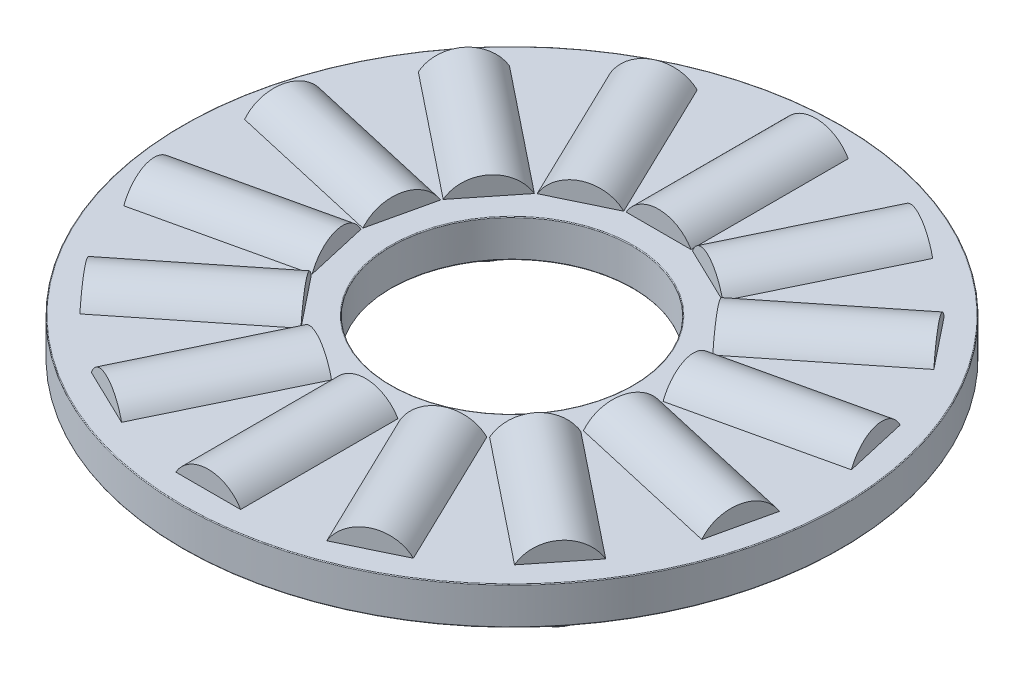
from build123d import *

# Parameters (mm, degrees)
SKETCH1_W         = 5.53085
SKETCH1_H         = 0.9921875
SKETCH3_W         = 4.1671875
SKETCH3_H         = 0.9921875
SKETCH2_W         = 4.1671875
SKETCH2_H         = 0.9921875
CIRPATTERN1_COUNT = 14
CIRPATTERN1_ANGLE = 334.285714286
CIRPATTERN2_COUNT = 14
FILLET2_R         = 0.01984375


with BuildPart() as part:
    # Sketch1 → Revolve1 (revolve)
    with BuildSketch(Plane(origin=(0, 0, 0), x_dir=(0, 0, -1), z_dir=(1, 0, 0)), mode=Mode.PRIVATE) as revolve1_sk:
        with Locations((-5.965825, 0)):
            Rectangle(SKETCH1_W, SKETCH1_H)
    revolve(revolve1_sk.sketch.rotate(Axis((0, -0.9921875, 0), (0, 1, 0)), 180), axis=Axis((0, -0.9921875, 0), (0, 1, 0)))

    # Sketch3 → Cut-Revolve1 (revolve, cut)
    with BuildSketch(Plane(origin=(0, 0, 0), x_dir=(0, 0, -1), z_dir=(1, 0, 0))):
        with Locations((-5.965825, 0.49609375)):
            Rectangle(SKETCH3_W, SKETCH3_H)
    cut_revolve1 = revolve(axis=Axis((0, 0, 8.04941875), (0, 0, -1)), mode=Mode.SUBTRACT)

    # CirPattern2: Cut-Revolve1 ×14 about axis
    cirpattern2_axis = Axis((0, 0, 0), (0, 1, 0))
    for i in range(1, CIRPATTERN2_COUNT):
        add(cut_revolve1.rotate(cirpattern2_axis, i * 360 / CIRPATTERN2_COUNT), mode=Mode.SUBTRACT)

    # Fillet2
    fillet2_edges = [part.edges().sort_by_distance(p)[0] for p in [
        (0, 0.49609375, 8.73125),
        (0, 0.49609375, 3.2004),
        (0, -0.49609375, 3.2004),
        (0, -0.49609375, 8.73125),
    ]]
    fillet(fillet2_edges, radius=FILLET2_R)


with BuildPart() as body_2:
    # Sketch2 → Revolve2 (revolve)
    with BuildSketch(Plane(origin=(0, 0, 0), x_dir=(0, 0, -1), z_dir=(1, 0, 0)), mode=Mode.PRIVATE) as revolve2_sk:
        with Locations((-5.965825, 0.49609375)):
            Rectangle(SKETCH2_W, SKETCH2_H)
    revolve(revolve2_sk.sketch.rotate(Axis((0, 0, 8.04941875), (0, 0, -1)), 90), axis=Axis((0, 0, 8.04941875), (0, 0, -1)))


with BuildPart() as cirpattern1_1:
    # CirPattern1: pattern copy
    add(body_2.part.rotate(Axis((0, 0.9921875, 0), (0, -1, 0)), 1 * CIRPATTERN1_ANGLE / (CIRPATTERN1_COUNT - 1)))


with BuildPart() as cirpattern1_2:
    # CirPattern1: pattern copy
    add(body_2.part.rotate(Axis((0, 0.9921875, 0), (0, -1, 0)), 2 * CIRPATTERN1_ANGLE / (CIRPATTERN1_COUNT - 1)))


with BuildPart() as cirpattern1_3:
    # CirPattern1: pattern copy
    add(body_2.part.rotate(Axis((0, 0.9921875, 0), (0, -1, 0)), 3 * CIRPATTERN1_ANGLE / (CIRPATTERN1_COUNT - 1)))


with BuildPart() as cirpattern1_4:
    # CirPattern1: pattern copy
    add(body_2.part.rotate(Axis((0, 0.9921875, 0), (0, -1, 0)), 4 * CIRPATTERN1_ANGLE / (CIRPATTERN1_COUNT - 1)))


with BuildPart() as cirpattern1_5:
    # CirPattern1: pattern copy
    add(body_2.part.rotate(Axis((0, 0.9921875, 0), (0, -1, 0)), 5 * CIRPATTERN1_ANGLE / (CIRPATTERN1_COUNT - 1)))


with BuildPart() as cirpattern1_6:
    # CirPattern1: pattern copy
    add(body_2.part.rotate(Axis((0, 0.9921875, 0), (0, -1, 0)), 6 * CIRPATTERN1_ANGLE / (CIRPATTERN1_COUNT - 1)))


with BuildPart() as cirpattern1_7:
    # CirPattern1: pattern copy
    add(body_2.part.rotate(Axis((0, 0.9921875, 0), (0, -1, 0)), 7 * CIRPATTERN1_ANGLE / (CIRPATTERN1_COUNT - 1)))


with BuildPart() as cirpattern1_8:
    # CirPattern1: pattern copy
    add(body_2.part.rotate(Axis((0, 0.9921875, 0), (0, -1, 0)), 8 * CIRPATTERN1_ANGLE / (CIRPATTERN1_COUNT - 1)))


with BuildPart() as cirpattern1_9:
    # CirPattern1: pattern copy
    add(body_2.part.rotate(Axis((0, 0.9921875, 0), (0, -1, 0)), 9 * CIRPATTERN1_ANGLE / (CIRPATTERN1_COUNT - 1)))


with BuildPart() as cirpattern1_10:
    # CirPattern1: pattern copy
    add(body_2.part.rotate(Axis((0, 0.9921875, 0), (0, -1, 0)), 10 * CIRPATTERN1_ANGLE / (CIRPATTERN1_COUNT - 1)))


with BuildPart() as cirpattern1_11:
    # CirPattern1: pattern copy
    add(body_2.part.rotate(Axis((0, 0.9921875, 0), (0, -1, 0)), 11 * CIRPATTERN1_ANGLE / (CIRPATTERN1_COUNT - 1)))


with BuildPart() as cirpattern1_12:
    # CirPattern1: pattern copy
    add(body_2.part.rotate(Axis((0, 0.9921875, 0), (0, -1, 0)), 12 * CIRPATTERN1_ANGLE / (CIRPATTERN1_COUNT - 1)))


with BuildPart() as cirpattern1_13:
    # CirPattern1: pattern copy
    add(body_2.part.rotate(Axis((0, 0.9921875, 0), (0, -1, 0)), 13 * CIRPATTERN1_ANGLE / (CIRPATTERN1_COUNT - 1)))


solid = Compound([part.part, body_2.part, cirpattern1_1.part, cirpattern1_2.part, cirpattern1_3.part, cirpattern1_4.part, cirpattern1_5.part, cirpattern1_6.part, cirpattern1_7.part, cirpattern1_8.part, cirpattern1_9.part, cirpattern1_10.part, cirpattern1_11.part, cirpattern1_12.part, cirpattern1_13.part])
